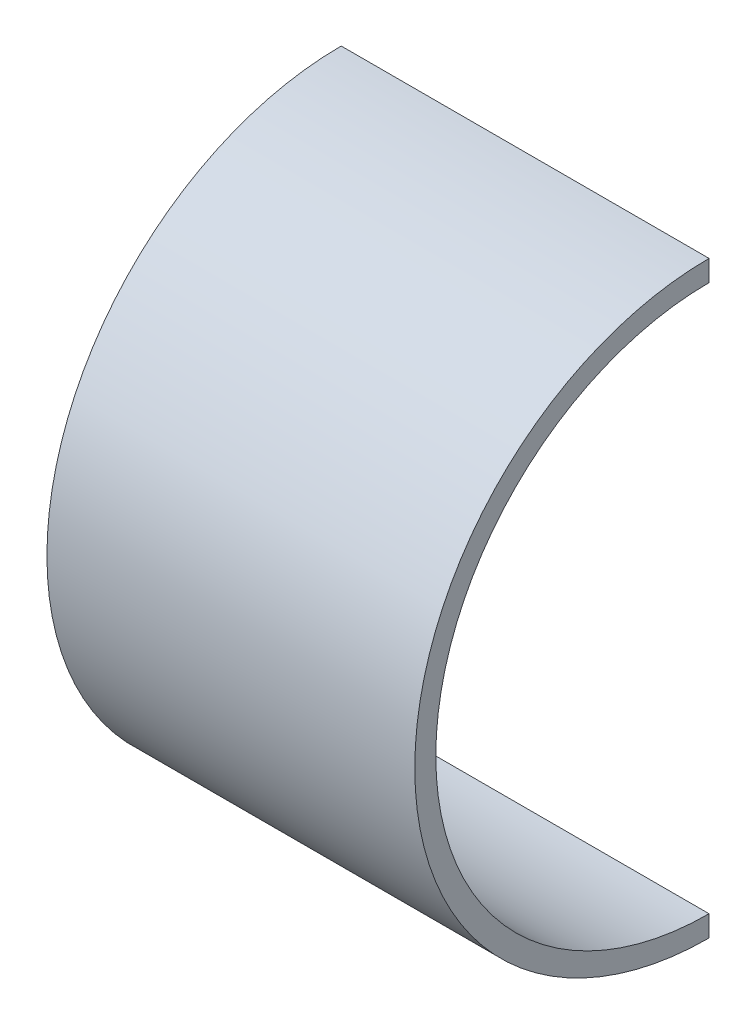
from build123d import *

# Parameters (mm, degrees)
BOSS_EXTRUDE1_DEPTH = 889


with BuildPart() as part:
    # Sketch1 → Boss-Extrude1 (new body)
    with BuildSketch(Plane(origin=(0, 0, 0), x_dir=(0, 0, -1), z_dir=(1, 0, 0))):
        with BuildLine():
            Line((0, 711.2), (0, 660.4))
            ThreePointArc((0, 660.4), (-660.4, 0), (0, -660.4))
            Line((0, -660.4), (0, -711.2))
            ThreePointArc((0, -711.2), (-711.2, 0), (0, 711.2))
        make_face()
    extrude(amount=BOSS_EXTRUDE1_DEPTH)


solid = part.part
